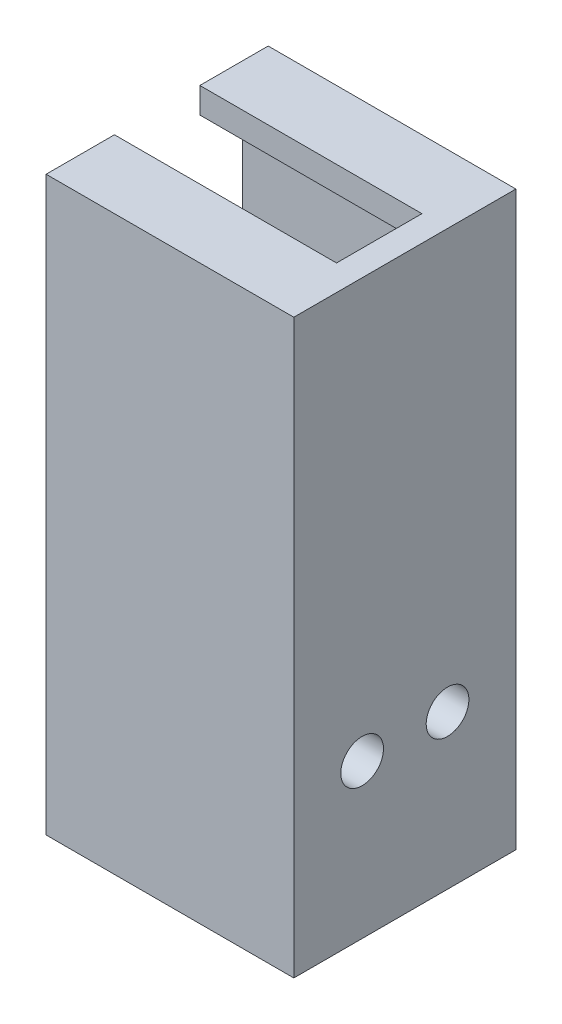
from build123d import *

# Parameters (mm, degrees)
SKETCH1_W           = 29
SKETCH1_H           = 47
BOSS_EXTRUDE1_DEPTH = 26
SHELL1_T            = -3
SKETCH2_W           = 10
SKETCH2_H           = 8.23076923
CUT_EXTRUDE1_DEPTH  = 26
SKETCH3_W           = 29
SKETCH3_H           = 26
BOSS_EXTRUDE2_DEPTH = 20
SKETCH4_R           = 2.5
CUT_EXTRUDE2_DEPTH  = 62.040969848


with BuildPart() as part:
    # Sketch1 → Boss-Extrude1 (new body)
    with BuildSketch(Plane.XY):
        with Locations((14.5, 23.5)):
            Rectangle(SKETCH1_W, SKETCH1_H)
    extrude(amount=BOSS_EXTRUDE1_DEPTH)

    # Shell1
    shell1_openings = [part.faces().sort_by_distance(p)[0] for p in [
        (0, 23.5, 13),
    ]]
    offset(amount=SHELL1_T, openings=shell1_openings, kind=Kind.INTERSECTION)

    # Sketch2 → Cut-Extrude1 (cut)
    with BuildSketch(Plane.ZY):
        with Locations((13, 44)):
            Rectangle(SKETCH2_W, SKETCH2_H)
    extrude(amount=-CUT_EXTRUDE1_DEPTH, mode=Mode.SUBTRACT)

    # Sketch3 → Boss-Extrude2 (add)
    with BuildSketch(Plane.XZ):
        with Locations((14.5, 13)):
            Rectangle(SKETCH3_W, SKETCH3_H)
    extrude(amount=BOSS_EXTRUDE2_DEPTH)

    # Sketch4 → Cut-Extrude2 (cut, through all)
    with BuildSketch(Plane.ZY):
        with Locations(Location((8, -2, 0), (0, 0, 270))):
            Circle(SKETCH4_R)
        with Locations(Location((18, -2, 0), (0, 0, 270))):
            Circle(SKETCH4_R)
    extrude(amount=-CUT_EXTRUDE2_DEPTH, mode=Mode.SUBTRACT)


solid = part.part
